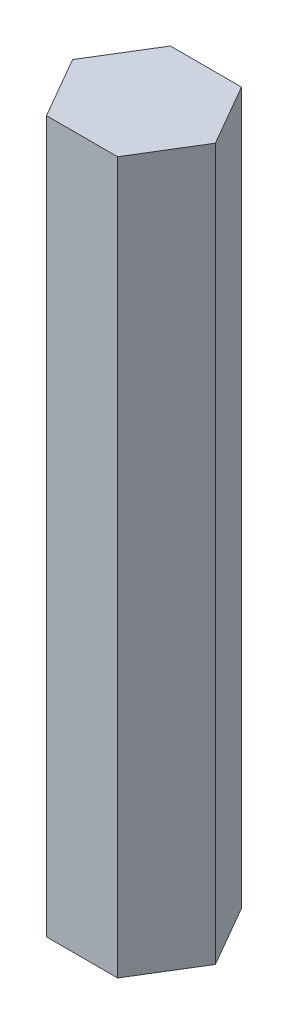
from build123d import *

# Parameters (mm, degrees)
EXTRUDE_1_DEPTH = 25


with BuildPart() as part:
    # 草图1 → 凸台-拉伸1 (new body)
    with BuildSketch(Plane(origin=(0, 0, 0), x_dir=(1, 0, 0), z_dir=(0, 1, 0))):
        Polygon((0, 0), (2.5, 0), (3.805384649, 2.13212826), (2.556078515, 4.297592225), (0.056078515, 4.297592225), (-1.249306134, 2.165463965), align=None)
    extrude(amount=EXTRUDE_1_DEPTH)


solid = part.part
